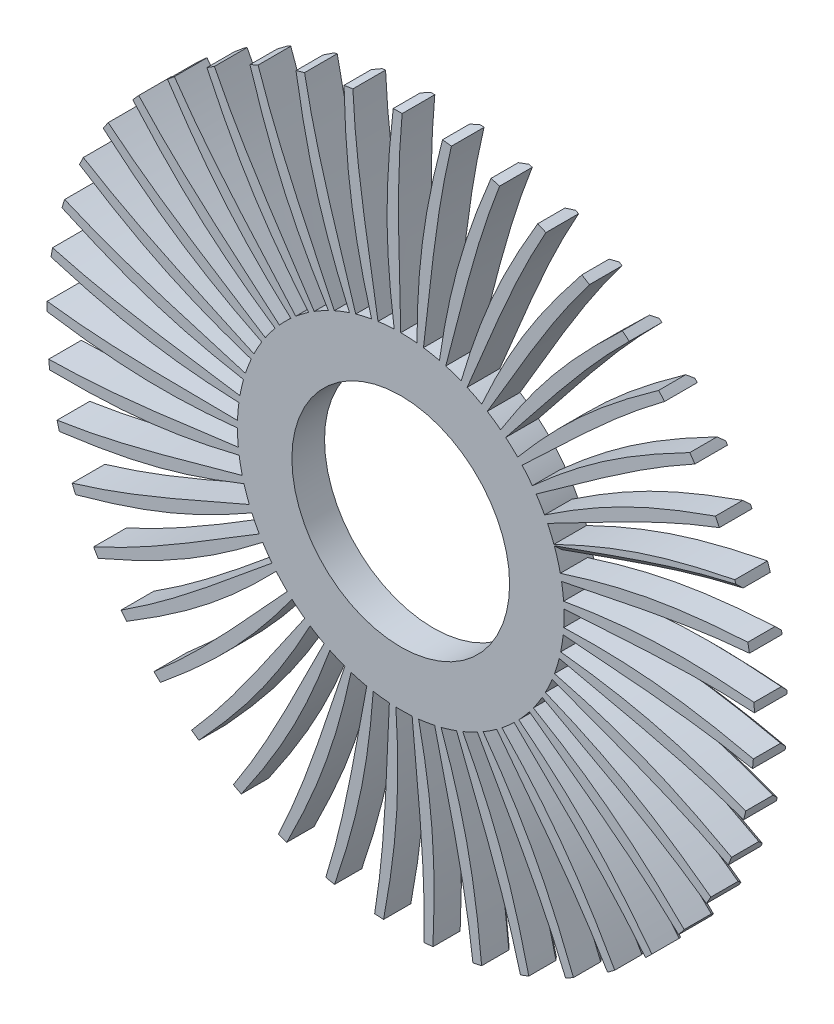
from build123d import *

# Parameters (mm, degrees)
BOSS_EXTRUDE1_DEPTH = 30
CHAMFER1_SIZE       = 5
SKETCH4_R           = 100
CUT_EXTRUDE4_DEPTH  = 30


with BuildPart() as part:
    # Sketch2 → Boss-Extrude1 (new body)
    with BuildSketch(Plane.XY):
        with BuildLine():
            ThreePointArc((255.305050597, -201.107760018), (257.825221713, -197.866508153), (260.304245812, -194.593678243))
            add(Edge.make_bspline(
                [(121.800982748, -87.547247825), (173.754400306, -117.703395416), (211.020458322, -147.138157234), (252.753415529, -187.143492092), (258.616357372, -192.917803148), (260.304245812, -194.593678243)],
                knots=[0, 0, 0, 0, 0.599000586, 0.668692091, 0.696915046, 0.696915046, 0.696915046, 0.696915046], degree=3))
            ThreePointArc((121.800982748, -87.547247825), (126.008666771, -81.37454085), (129.903810568, -75))
            add(Edge.make_bspline(
                [(129.903810568, -75), (182.276784142, -103.810645255), (231.484860292, -128.523589977), (280.809229984, -163.61899754)],
                knots=[0, 0, 0, 0, 0.716119663, 0.716119663, 0.716119663, 0.716119663], degree=3))
            ThreePointArc((280.809229984, -163.61899754), (282.853779894, -160.058549286), (284.853188414, -156.472556861))
            add(Edge.make_bspline(
                [(132.799845917, -69.743823558), (188.44458096, -92.375975367), (229.444495339, -116.337847252), (276.338976783, -150.145747874), (282.948489654, -155.047899935), (284.853188414, -156.472556861)],
                knots=[0, 0, 0, 0, 0.599000586, 0.668692091, 0.696915046, 0.696915046, 0.696915046, 0.696915046], degree=3))
            ThreePointArc((132.799845917, -69.743823558), (136.107506278, -63.04559251), (139.077578185, -56.190989012))
            add(Edge.make_bspline(
                [(139.077578185, -56.190989012), (194.950528422, -77.43234191), (247.119092108, -95.056341403), (300.847777124, -122.945577388)],
                knots=[0, 0, 0, 0, 0.716119663, 0.716119663, 0.716119663, 0.716119663], degree=3))
            ThreePointArc((300.847777124, -122.945577388), (302.376910991, -119.135232821), (303.857787719, -115.305875144))
            add(Edge.make_bspline(
                [(141.213911143, -50.582915098), (199.466902198, -65.250562033), (243.402656244, -83.273153405), (294.545914185, -110.225587462), (301.773351434, -114.160165714), (303.857787719, -115.305875144)],
                knots=[0, 0, 0, 0, 0.599000586, 0.668692091, 0.696915046, 0.696915046, 0.696915046, 0.696915046], degree=3))
            ThreePointArc((141.213911143, -50.582915098), (143.557167994, -43.489533425), (145.544358941, -36.28828434))
            add(Edge.make_bspline(
                [(145.544358941, -36.28828434), (203.829782419, -49.546906107), (257.94343189, -59.738929267), (315.030664493, -79.879161421)],
                knots=[0, 0, 0, 0, 0.716119663, 0.716119663, 0.716119663, 0.716119663], degree=3))
            ThreePointArc((315.030664493, -79.879161421), (316.014619465, -75.893084563), (316.948140819, -71.894895725))
            add(Edge.make_bspline(
                [(146.879408216, -30.437467733), (206.606827075, -36.855120731), (252.623261311, -48.587642349), (307.019850407, -68.16001137), (314.724538191, -71.050433722), (316.948140819, -71.894895725)],
                knots=[0, 0, 0, 0, 0.599000586, 0.668692091, 0.696915046, 0.696915046, 0.696915046, 0.696915046], degree=3))
            ThreePointArc((146.879408216, -30.437467733), (148.21265273, -23.08700004), (149.178284305, -15.67926949))
            add(Edge.make_bspline(
                [(149.178284305, -15.67926949), (208.741721554, -20.697096135), (263.747196176, -23.258766826), (323.081838319, -35.257988438)],
                knots=[0, 0, 0, 0, 0.716119663, 0.716119663, 0.716119663, 0.716119663], degree=3))
            ThreePointArc((323.081838319, -35.257988438), (323.501462832, -31.173763742), (323.869458881, -27.084563941))
            add(Edge.make_bspline(
                [(149.686064682, -9.699589681), (209.725385075, -7.742336426), (256.926841952, -12.956428102), (313.517994472, -24.767778187), (321.549969806, -26.557785857), (323.869458881, -27.084563941)],
                knots=[0, 0, 0, 0, 0.599000586, 0.668692091, 0.696915046, 0.696915046, 0.696915046, 0.696915046], degree=3))
            ThreePointArc((149.686064682, -9.699589681), (149.983346769, -2.235104461), (149.908624053, 5.234924505))
            add(Edge.make_bspline(
                [(149.908624053, 5.234924505), (209.590740519, 8.55555927), (264.417421297, 13.674101055), (324.844591662, 10.049441184)],
                knots=[0, 0, 0, 0, 0.716119663, 0.716119663, 0.716119663, 0.716119663], degree=3))
            ThreePointArc((324.844591662, 10.049441184), (324.691718202, 14.152318931), (324.487026323, 18.252938072))
            add(Edge.make_bspline(
                [(149.579252164, 11.227079851), (208.761877013, 21.521143651), (256.229633864, 22.92696828), (313.913867396, 19.106531625), (322.116797016, 18.4517791), (324.487026323, 18.252938072)],
                knots=[0, 0, 0, 0, 0.599000586, 0.668692091, 0.696915046, 0.696915046, 0.696915046, 0.696915046], degree=3))
            ThreePointArc((149.579252164, 11.227079851), (148.834785567, 18.660294884), (147.721162952, 26.04722665))
            add(Edge.make_bspline(
                [(147.721162952, 26.04722665), (206.360314125, 37.641690446), (259.941062083, 50.340818114), (320.284614534, 55.161269865)],
                knots=[0, 0, 0, 0, 0.716119663, 0.716119663, 0.716119663, 0.716119663], degree=3))
            ThreePointArc((320.284614534, 55.161269865), (319.562218609, 59.202942815), (318.788822895, 63.235167408))
            add(Edge.make_bspline(
                [(146.561049647, 31.935227045), (203.735056479, 50.365739146), (250.54520741, 58.364117303), (308.199763963, 62.608954532), (316.413987174, 63.102201167), (318.788822895, 63.235167408)],
                knots=[0, 0, 0, 0, 0.599000586, 0.668692091, 0.696915046, 0.696915046, 0.696915046, 0.696915046], degree=3))
            ThreePointArc((146.561049647, 31.935227045), (144.789324561, 39.192492815), (142.658477444, 46.352549156))
            add(Edge.make_bspline(
                [(142.658477444, 46.352549156), (199.113318949, 65.995168934), (250.405245773, 86.027708409), (309.490661702, 99.199447173)],
                knots=[0, 0, 0, 0, 0.716119663, 0.716119663, 0.716119663, 0.716119663], degree=3))
            ThreePointArc((309.490661702, 99.199447173), (308.212803927, 103.101248758), (306.885757647, 106.98659614))
            add(Edge.make_bspline(
                [(140.690203009, 52.02179137), (194.742764815, 78.230022819), (239.984203484, 92.665275172), (296.486902696, 104.892765357), (304.552538988, 106.524410665), (306.885757647, 106.98659614)],
                knots=[0, 0, 0, 0, 0.599000586, 0.668692091, 0.696915046, 0.696915046, 0.696915046, 0.696915046], degree=3))
            ThreePointArc((140.690203009, 52.02179137), (137.925704048, 58.961853455), (134.819106945, 65.755672018))
            add(Edge.make_bspline(
                [(134.819106945, 65.755672018), (187.990809508, 93.064126527), (235.995576187, 120.040167216), (292.67282518, 141.306820079)],
                knots=[0, 0, 0, 0, 0.716119663, 0.716119663, 0.716119663, 0.716119663], degree=3))
            ThreePointArc((292.67282518, 141.306820079), (290.864377604, 144.992806171), (289.009510203, 148.655652473))
            add(Edge.make_bspline(
                [(132.080981602, 71.0958107), (181.960026751, 104.571648084), (224.752180016, 125.162808864), (279.003261117, 145.134957817), (286.763322054, 147.873243679), (289.009510203, 148.655652473)],
                knots=[0, 0, 0, 0, 0.599000586, 0.668692091, 0.696915046, 0.696915046, 0.696915046, 0.696915046], degree=3))
            ThreePointArc((132.080981602, 71.0958107), (128.377516594, 77.583588684), (124.355635883, 83.878935521))
            add(Edge.make_bspline(
                [(124.355635883, 83.878935521), (173.209272795, 118.321696756), (216.992521151, 151.716180711), (270.158445027, 180.663816467)],
                knots=[0, 0, 0, 0, 0.716119663, 0.716119663, 0.716119663, 0.716119663], degree=3))
            ThreePointArc((270.158445027, 180.663816467), (267.854607024, 184.062243538), (265.508021387, 187.431295623))
            add(Edge.make_bspline(
                [(120.900954128, 88.786030945), (165.635643742, 128.877905167), (205.145611015, 155.224190852), (256.089138422, 182.552263412), (263.392583244, 186.343892208), (265.508021387, 187.431295623)],
                knots=[0, 0, 0, 0, 0.599000586, 0.668692091, 0.696915046, 0.696915046, 0.696915046, 0.696915046], degree=3))
            ThreePointArc((120.900954128, 88.786030945), (116.330606807, 94.69524761), (111.471723822, 100.369590954))
            add(Edge.make_bspline(
                [(111.471723822, 100.369590954), (155.056414611, 141.276269747), (193.765953516, 180.439211323), (242.385738042, 216.504397169)],
                knots=[0, 0, 0, 0, 0.716119663, 0.716119663, 0.716119663, 0.716119663], degree=3))
            ThreePointArc((242.385738042, 216.504397169), (239.631351198, 219.549118703), (236.838720946, 222.558801805))
            add(Edge.make_bspline(
                [(107.367727105, 104.74813209), (146.087351336, 150.675700422), (181.546116046, 182.264310531), (228.190531944, 216.416396849), (234.895207407, 221.187568839), (236.838720946, 222.558801805)],
                knots=[0, 0, 0, 0, 0.599000586, 0.668692091, 0.696915046, 0.696915046, 0.696915046, 0.696915046], degree=3))
            ThreePointArc((107.367727105, 104.74813209), (102.019454082, 109.963771256), (96.418141453, 114.906666468))
            add(Edge.make_bspline(
                [(96.418141453, 114.906666468), (133.88555969, 161.481060847), (166.767952002, 205.650197933), (209.895268376, 248.130966051)],
                knots=[0, 0, 0, 0, 0.716119663, 0.716119663, 0.716119663, 0.716119663], degree=3))
            ThreePointArc((209.895268376, 248.130966051), (206.743943698, 250.762720005), (203.559624201, 253.354454066))
            add(Edge.make_bspline(
                [(91.744709403, 118.671429993), (123.695634808, 169.54076456), (154.413032434, 205.756862727), (195.850456325, 246.068231292), (201.825863546, 251.726081039), (203.559624201, 253.354454066)],
                knots=[0, 0, 0, 0, 0.599000586, 0.668692091, 0.696915046, 0.696915046, 0.696915046, 0.696915046], degree=3))
            ThreePointArc((91.744709403, 118.671429993), (85.722608729, 123.091975176), (79.487889635, 127.207214423))
            add(Edge.make_bspline(
                [(79.487889635, 127.207214423), (110.108774642, 178.542806779), (136.524001997, 226.858437365), (173.319426063, 274.927947923)],
                knots=[0, 0, 0, 0, 0.716119663, 0.716119663, 0.716119663, 0.716119663], degree=3))
            ThreePointArc((173.319426063, 274.927947923), (169.832500501, 277.095510201), (166.318470917, 279.218850066))
            add(Edge.make_bspline(
                [(74.33598529, 130.284923498), (98.89632345, 185.105910565), (124.274474787, 225.244591636), (159.698374351, 270.930627512), (164.828208825, 277.365031406), (166.318470917, 279.218850066)],
                knots=[0, 0, 0, 0, 0.599000586, 0.668692091, 0.696915046, 0.696915046, 0.696915046, 0.696915046], degree=3))
            ThreePointArc((74.33598529, 130.284923498), (67.757270305, 133.824333814), (61.010496461, 137.031818646))
            add(Edge.make_bspline(
                [(61.010496461, 137.031818646), (84.188847543, 192.129420066), (103.622767587, 243.651135361), (133.37011827, 296.373770015)],
                knots=[0, 0, 0, 0, 0.716119663, 0.716119663, 0.716119663, 0.716119663], degree=3))
            ThreePointArc((133.37011827, 296.373770015), (129.615460864, 298.034951482), (125.840117781, 299.648568755))
            add(Edge.make_bspline(
                [(55.480395779, 139.362569165), (72.172107649, 197.068180576), (91.717055849, 240.34819078), (120.437945174, 290.519667246), (124.622360509, 297.605386935), (125.840117781, 299.648568755)],
                knots=[0, 0, 0, 0, 0.599000586, 0.668692091, 0.696915046, 0.696915046, 0.696915046, 0.696915046], degree=3))
            ThreePointArc((55.480395779, 139.362569165), (48.473113687, 141.951954018), (41.345603373, 144.189254391))
            add(Edge.make_bspline(
                [(41.345603373, 144.189254391), (56.630280289, 201.976452736), (68.704633876, 255.701441155), (90.82491283, 312.051013793)],
                knots=[0, 0, 0, 0, 0.716119663, 0.716119663, 0.716119663, 0.716119663], degree=3))
            ThreePointArc((90.82491283, 312.051013793), (86.875603717, 313.173481443), (82.912429893, 314.245968899))
            add(Edge.make_bspline(
                [(35.544943473, 145.727680945), (44.043143868, 205.194742614), (57.374468745, 250.773685782), (78.83332839, 304.454072118), (81.990879701, 312.053192128), (82.912429893, 314.245968899)],
                knots=[0, 0, 0, 0, 0.599000586, 0.668692091, 0.696915046, 0.696915046, 0.696915046, 0.696915046], degree=3))
            ThreePointArc((35.544943473, 145.727680945), (28.245483049, 147.316640904), (20.875965144, 148.540210311))
            add(Edge.make_bspline(
                [(20.875965144, 148.540210311), (27.969469046, 207.892243498), (32.449242616, 262.774809254), (46.511903775, 321.654539541)],
                knots=[0, 0, 0, 0, 0.716119663, 0.716119663, 0.716119663, 0.716119663], degree=3))
            ThreePointArc((46.511903775, 321.654539541), (42.444811762, 322.216445816), (38.370945869, 322.726928708))
            add(Edge.make_bspline(
                [(14.917649274, 149.256369178), (15.056930389, 209.327422392), (21.91515287, 256.318156242), (35.69431054, 312.462624788), (37.763539683, 320.427236892), (38.370945869, 322.726928708)],
                knots=[0, 0, 0, 0, 0.599000586, 0.668692091, 0.696915046, 0.696915046, 0.696915046, 0.696915046], degree=3))
            ThreePointArc((14.917649274, 149.256369178), (7.468086212, 149.813976946), (0, 150))
            add(Edge.make_bspline(
                [(0, 150), (-1.235736097, 209.761648215), (-4.43773624, 264.733564593), (1.293593419, 324.997425553)],
                knots=[0, 0, 0, 0, 0.716119663, 0.716119663, 0.716119663, 0.716119663], degree=3))
            ThreePointArc((1.293593419, 324.997425553), (-2.812120173, 324.987833588), (-6.91738497, 324.926375946))
            add(Edge.make_bspline(
                [(-6, 149.879951962), (-14.222349113, 209.385782), (-13.970716528, 256.873685348), (-8.139456462, 314.389447887), (-7.19882468, 322.56452997), (-6.91738497, 324.926375946)],
                knots=[0, 0, 0, 0, 0.599000586, 0.668692091, 0.696915046, 0.696915046, 0.696915046, 0.696915046], degree=3))
            ThreePointArc((-6, 149.879951962), (-13.454668429, 149.395354337), (-20.875965144, 148.540210311))
            add(Edge.make_bspline(
                [(-20.875965144, 148.540210311), (-30.416889043, 207.548281049), (-41.238339609, 261.539582227), (-43.949895261, 322.014606356)],
                knots=[0, 0, 0, 0, 0.716119663, 0.716119663, 0.716119663, 0.716119663], degree=3))
            ThreePointArc((-43.949895261, 322.014606356), (-48.014317387, 321.433702847), (-52.071076779, 320.801500874))
            add(Edge.make_bspline(
                [(-26.800866099, 147.586291966), (-43.224806767, 205.368685534), (-49.58466182, 252.429460358), (-51.814798203, 310.197037996), (-52.021072109, 318.423471384), (-52.071076779, 320.801500874)],
                knots=[0, 0, 0, 0, 0.599000586, 0.668692091, 0.696915046, 0.696915046, 0.696915046, 0.696915046], degree=3))
            ThreePointArc((-26.800866099, 147.586291966), (-34.115543253, 146.068921091), (-41.345603373, 144.189254391))
            add(Edge.make_bspline(
                [(-41.345603373, 144.189254391), (-59.006011842, 201.295222676), (-77.236285605, 253.255029389), (-88.337949224, 312.764139132)],
                knots=[0, 0, 0, 0, 0.716119663, 0.716119663, 0.716119663, 0.716119663], degree=3))
            ThreePointArc((-88.337949224, 312.764139132), (-92.281970529, 311.623230705), (-96.211264309, 310.432589494))
            add(Edge.make_bspline(
                [(-47.080083824, 142.420032675), (-71.385942725, 197.354321208), (-84.233498072, 243.071983057), (-94.481623835, 299.966995604), (-95.830788542, 308.084662129), (-96.211264309, 310.432589494)],
                knots=[0, 0, 0, 0, 0.599000586, 0.668692091, 0.696915046, 0.696915046, 0.696915046, 0.696915046], degree=3))
            ThreePointArc((-47.080083824, 142.420032675), (-54.112397833, 139.899422446), (-61.010496461, 137.031818646))
            add(Edge.make_bspline(
                [(-61.010496461, 137.031818646), (-86.446649739, 191.124181763), (-111.730915157, 240.041155478), (-131.006605486, 297.426073704)],
                knots=[0, 0, 0, 0, 0.716119663, 0.716119663, 0.716119663, 0.716119663], degree=3))
            ThreePointArc((-131.006605486, 297.426073704), (-134.753460084, 295.747366844), (-138.478809017, 294.021460872))
            add(Edge.make_bspline(
                [(-66.442941271, 134.481729448), (-98.157632508, 185.498679506), (-117.242825097, 228.983386096), (-135.309472131, 283.89843685), (-137.775267682, 291.749335366), (-138.478809017, 294.021460872)],
                knots=[0, 0, 0, 0, 0.599000586, 0.668692091, 0.696915046, 0.696915046, 0.696915046, 0.696915046], degree=3))
            ThreePointArc((-66.442941271, 134.481729448), (-73.056016141, 131.006940677), (-79.487889635, 127.207214423))
            add(Edge.make_bspline(
                [(-79.487889635, 127.207214423), (-112.204701931, 177.233126052), (-144.050829537, 222.155153518), (-171.125367191, 276.298948068)],
                knots=[0, 0, 0, 0, 0.716119663, 0.716119663, 0.716119663, 0.716119663], degree=3))
            ThreePointArc((-171.125367191, 276.298948068), (-174.602126818, 274.115116895), (-178.051021226, 271.887538958))
            add(Edge.make_bspline(
                [(-84.512562444, 123.925892328), (-123.018795627, 170.03251701), (-147.970153894, 210.437887989), (-173.503675463, 262.304117953), (-177.038107954, 269.735439651), (-178.051021226, 271.887538958)],
                knots=[0, 0, 0, 0, 0.599000586, 0.668692091, 0.696915046, 0.696915046, 0.696915046, 0.696915046], degree=3))
            ThreePointArc((-84.512562444, 123.925892328), (-90.577682196, 119.564557826), (-96.418141453, 114.906666468))
            add(Edge.make_bspline(
                [(-96.418141453, 114.906666468), (-135.77881723, 159.892429143), (-173.566958376, 199.945154193), (-207.913368276, 249.793977694)],
                knots=[0, 0, 0, 0, 0.716119663, 0.716119663, 0.716119663, 0.716119663], degree=3))
            ThreePointArc((-207.913368276, 249.793977694), (-211.052361761, 247.147527997), (-214.157672836, 244.461635366))
            add(Edge.make_bspline(
                [(-100.93724272, 110.957978677), (-145.48553782, 151.256864979), (-175.817411959, 187.796455762), (-208.320827111, 235.604347766), (-212.855102832, 242.471450422), (-214.157672836, 244.461635366)],
                knots=[0, 0, 0, 0, 0.599000586, 0.668692091, 0.696915046, 0.696915046, 0.696915046, 0.696915046], degree=3))
            ThreePointArc((-100.93724272, 110.957978677), (-106.336356696, 105.794986859), (-111.471723822, 100.369590954))
            add(Edge.make_bspline(
                [(-111.471723822, 100.369590954), (-156.710152298, 139.439607975), (-199.704803799, 173.843449876), (-240.654572145, 218.427051681)],
                knots=[0, 0, 0, 0, 0.716119663, 0.716119663, 0.716119663, 0.716119663], degree=3))
            ThreePointArc((-240.654572145, 218.427051681), (-243.39470255, 215.369493593), (-246.095988945, 212.277564112))
            add(Edge.make_bspline(
                [(-115.397294381, 95.830394184), (-165.120569508, 129.537170123), (-200.24258409, 161.499779139), (-239.08325082, 204.318806946), (-244.529115253, 210.488030218), (-246.095988945, 212.277564112)],
                knots=[0, 0, 0, 0, 0.599000586, 0.668692091, 0.696915046, 0.696915046, 0.696915046, 0.696915046], degree=3))
            ThreePointArc((-115.397294381, 95.830394184), (-120.02531497, 89.966236813), (-124.355635883, 83.878935521))
            add(Edge.make_bspline(
                [(-124.355635883, 83.878935521), (-174.591302507, 116.272753448), (-221.955622377, 144.35808055), (-268.711708508, 182.808691563)],
                knots=[0, 0, 0, 0, 0.716119663, 0.716119663, 0.716119663, 0.716119663], degree=3))
            ThreePointArc((-268.711708508, 182.808691563), (-270.999642312, 179.399536975), (-273.244326559, 175.961751535))
            add(Edge.make_bspline(
                [(-127.61126897, 78.837580074), (-181.541717132, 105.296181597), (-220.770262093, 132.059693018), (-265.192191005, 169.056432957), (-271.443646593, 174.407699933), (-273.244326559, 175.961751535)],
                knots=[0, 0, 0, 0, 0.599000586, 0.668692091, 0.696915046, 0.696915046, 0.696915046, 0.696915046], degree=3))
            ThreePointArc((-127.61126897, 78.837580074), (-131.378117014, 72.386396303), (-134.819106945, 65.755672018))
            add(Edge.make_bspline(
                [(-134.819106945, 65.755672018), (-189.074231607, 90.842782034), (-239.886327237, 112.062945392), (-291.538677119, 143.632168206)],
                knots=[0, 0, 0, 0, 0.716119663, 0.716119663, 0.716119663, 0.716119663], degree=3))
            ThreePointArc((-291.538677119, 143.632168206), (-293.329882293, 139.937772434), (-295.074274168, 136.221043618))
            add(Edge.make_bspline(
                [(-137.341435363, 60.310282144), (-194.429361732, 79.00572267), (-237.000898068, 100.049215188), (-286.139466844, 130.503567801), (-293.074836115, 134.932722154), (-295.074274168, 136.221043618)],
                knots=[0, 0, 0, 0, 0.599000586, 0.668692091, 0.696915046, 0.696915046, 0.696915046, 0.696915046], degree=3))
            ThreePointArc((-137.341435363, 60.310282144), (-140.173793452, 53.397636927), (-142.658477444, 46.352549156))
            add(Edge.make_bspline(
                [(-142.658477444, 46.352549156), (-199.877045858, 63.644659199), (-253.147917603, 77.586632472), (-308.691177001, 101.660008075)],
                knots=[0, 0, 0, 0, 0.716119663, 0.716119663, 0.716119663, 0.716119663], degree=3))
            ThreePointArc((-308.691177001, 101.660008075), (-309.950789774, 97.752278329), (-311.160936672, 93.828948036))
            add(Edge.make_bspline(
                [(-144.398406941, 40.609113174), (-203.532659967, 51.177507218), (-248.618581146, 66.091393189), (-301.517363439, 89.410599142), (-309.001657319, 92.831432422), (-311.160936672, 93.828948036)],
                knots=[0, 0, 0, 0, 0.599000586, 0.668692091, 0.696915046, 0.696915046, 0.696915046, 0.696915046], degree=3))
            ThreePointArc((-144.398406941, 40.609113174), (-146.241146445, 33.369553287), (-147.721162952, 26.04722665))
            add(Edge.make_bspline(
                [(-147.721162952, 26.04722665), (-206.789480768, 35.207765468), (-261.482271705, 41.600184004), (-319.835354254, 57.709151522)],
                knots=[0, 0, 0, 0, 0.716119663, 0.716119663, 0.716119663, 0.716119663], degree=3))
            ThreePointArc((-319.835354254, 57.709151522), (-320.538857695, 53.664147318), (-321.191205484, 49.61057871))
            add(Edge.make_bspline(
                [(-148.644827779, 20.117534009), (-208.67442649, 22.353179801), (-255.397186342, 30.847177399), (-311.026567526, 46.577354874), (-318.914112748, 48.923284452), (-321.191205484, 49.61057871)],
                knots=[0, 0, 0, 0, 0.599000586, 0.668692091, 0.696915046, 0.696915046, 0.696915046, 0.696915046], degree=3))
            ThreePointArc((-148.644827779, 20.117534009), (-149.462081869, 12.69196925), (-149.908624053, 5.234924505))
            add(Edge.make_bspline(
                [(-149.908624053, 5.234924505), (-209.676993654, 6.08559263), (-264.727170819, 4.804035273), (-324.754300143, 12.635051978)],
                knots=[0, 0, 0, 0, 0.716119663, 0.716119663, 0.716119663, 0.716119663], degree=3))
            ThreePointArc((-324.754300143, 12.635051978), (-324.888001359, 8.531504722), (-324.969852831, 4.4265959))
            add(Edge.make_bspline(
                [(-149.998046125, -0.765610073), (-209.754582665, -6.906226834), (-257.204775815, -4.99744361), (-314.481993264, 2.837535375), (-322.619267732, 4.0629004), (-324.969852831, 4.4265959)],
                knots=[0, 0, 0, 0, 0.599000586, 0.668692091, 0.696915046, 0.696915046, 0.696915046, 0.696915046], degree=3))
            ThreePointArc((-149.998046125, -0.765610073), (-149.77390788, -8.232649532), (-149.178284305, -15.67926949))
            add(Edge.make_bspline(
                [(-149.178284305, -15.67926949), (-208.483382363, -23.155029346), (-262.819456677, -32.085618539), (-323.352272983, -32.68497448)],
                knots=[0, 0, 0, 0, 0.716119663, 0.716119663, 0.716119663, 0.716119663], degree=3))
            ThreePointArc((-323.352272983, -32.68497448), (-322.913569631, -36.76719391), (-322.42333164, -40.843545564))
            add(Edge.make_bspline(
                [(-148.431723123, -21.633852425), (-206.752104481, -36.031211619), (-254.006166893, -40.744795065), (-311.816384721, -40.957513523), (-320.045005643, -40.876563387), (-322.42333164, -40.843545564)],
                knots=[0, 0, 0, 0, 0.599000586, 0.668692091, 0.696915046, 0.696915046, 0.696915046, 0.696915046], degree=3))
            ThreePointArc((-148.431723123, -21.633852425), (-147.17055514, -28.997029155), (-145.544358941, -36.28828434))
            add(Edge.make_bspline(
                [(-145.544358941, -36.28828434), (-203.231879181, -51.944965014), (-255.796260763, -68.350762283), (-315.656561637, -77.368825089)],
                knots=[0, 0, 0, 0, 0.716119663, 0.716119663, 0.716119663, 0.716119663], degree=3))
            ThreePointArc((-315.656561637, -77.368825089), (-314.653992579, -81.350260934), (-313.60120705, -85.318713873))
            add(Edge.make_bspline(
                [(-143.976345469, -42.081016449), (-199.72543176, -64.454889855), (-245.863616861, -75.699095429), (-303.081624935, -83.955371009), (-311.241431566, -85.020411365), (-313.60120705, -85.318713873)],
                knots=[0, 0, 0, 0, 0.599000586, 0.668692091, 0.696915046, 0.696915046, 0.696915046, 0.696915046], degree=3))
            ThreePointArc((-143.976345469, -42.081016449), (-141.702694948, -49.19701459), (-139.077578185, -56.190989012))
            add(Edge.make_bspline(
                [(-139.077578185, -56.190989012), (-194.024698643, -79.723851025), (-243.794281597, -103.285536188), (-301.816954373, -120.546779523)],
                knots=[0, 0, 0, 0, 0.716119663, 0.716119663, 0.716119663, 0.716119663], degree=3))
            ThreePointArc((-301.816954373, -120.546779523), (-300.270033475, -124.349937663), (-298.675191681, -128.133250464))
            add(Edge.make_bspline(
                [(-136.718632022, -61.709121353), (-188.811330695, -91.624026976), (-232.935611192, -109.179999008), (-288.44772607, -125.319132695), (-296.379897054, -127.509433744), (-298.675191681, -128.133250464)],
                knots=[0, 0, 0, 0, 0.599000586, 0.668692091, 0.696915046, 0.696915046, 0.696915046, 0.696915046], degree=3))
            ThreePointArc((-136.718632022, -61.709121353), (-133.476752983, -68.439436096), (-129.903810568, -75))
            add(Edge.make_bspline(
                [(-129.903810568, -75), (-181.041048045, -105.95100296), (-227.047124052, -136.209974616), (-282.102823403, -161.378428013)],
                knots=[0, 0, 0, 0, 0.716119663, 0.716119663, 0.716119663, 0.716119663], degree=3))
            ThreePointArc((-282.102823403, -161.378428013), (-280.041659722, -164.929284302), (-277.935803443, -168.453819085))
            add(Edge.make_bspline(
                [(-126.799845917, -80.136128403), (-174.222231847, -117.009806633), (-215.473778811, -140.535838097), (-268.199520321, -164.243700013), (-275.749664974, -167.516630035), (-277.935803443, -168.453819085)],
                knots=[0, 0, 0, 0, 0.599000586, 0.668692091, 0.696915046, 0.696915046, 0.696915046, 0.696915046], degree=3))
            ThreePointArc((-126.799845917, -80.136128403), (-122.652837849, -86.349761827), (-118.201613041, -92.349221299))
            add(Edge.make_bspline(
                [(-118.201613041, -92.349221299), (-164.533639379, -130.11593914), (-205.880752499, -166.483240824), (-256.897881863, -199.069028968)],
                knots=[0, 0, 0, 0, 0.716119663, 0.716119663, 0.716119663, 0.716119663], degree=3))
            ThreePointArc((-256.897881863, -199.069028968), (-254.362593604, -202.298470026), (-251.786710939, -205.49562573))
            add(Edge.make_bspline(
                [(-114.413045044, -97.003376868), (-156.242095431, -140.118123501), (-193.817994424, -169.156306954), (-242.731115982, -199.971450533), (-249.752279326, -204.26330567), (-251.786710939, -205.49562573)],
                knots=[0, 0, 0, 0, 0.599000586, 0.668692091, 0.696915046, 0.696915046, 0.696915046, 0.696915046], degree=3))
            ThreePointArc((-114.413045044, -97.003376868), (-109.441624742, -102.579387666), (-104.198755569, -107.900970051))
            add(Edge.make_bspline(
                [(-104.198755569, -107.900970051), (-144.823770577, -151.748316569), (-180.707146285, -193.516100122), (-226.69271527, -232.884977711)],
                knots=[0, 0, 0, 0, 0.716119663, 0.716119663, 0.716119663, 0.716119663], degree=3))
            ThreePointArc((-226.69271527, -232.884977711), (-223.732648936, -235.730146142), (-220.73687651, -238.537693769))
            add(Edge.make_bspline(
                [(-99.799324392, -111.982564942), (-135.22088435, -160.499200477), (-168.38976324, -194.484340708), (-212.538226573, -231.806984234), (-218.893749649, -237.034228406), (-220.73687651, -238.537693769)],
                knots=[0, 0, 0, 0, 0.599000586, 0.668692091, 0.696915046, 0.696915046, 0.696915046, 0.696915046], degree=3))
            ThreePointArc((-99.799324392, -111.982564942), (-94.100254897, -116.812422406), (-88.167787844, -121.352549156))
            add(Edge.make_bspline(
                [(-88.167787844, -121.352549156), (-122.295071814, -170.427085628), (-152.01628102, -216.782388653), (-192.075232833, -262.168085266)],
                knots=[0, 0, 0, 0, 0.716119663, 0.716119663, 0.716119663, 0.716119663], degree=3))
            ThreePointArc((-192.075232833, -262.168085266), (-188.748002748, -264.573603103), (-185.390649864, -266.936896931))
            add(Edge.make_bspline(
                [(-83.243123411, -124.782139767), (-111.567752567, -177.75634308), (-139.684016855, -216.026957994), (-178.208522342, -259.130658663), (-183.774702124, -265.191549509), (-185.390649864, -266.936896931)],
                knots=[0, 0, 0, 0, 0.599000586, 0.668692091, 0.696915046, 0.696915046, 0.696915046, 0.696915046], degree=3))
            ThreePointArc((-83.243123411, -124.782139767), (-76.927330628, -128.771836216), (-70.420734418, -132.442138929))
            add(Edge.make_bspline(
                [(-70.420734418, -132.442138929), (-97.386038588, -185.788685322), (-120.36659176, -235.829254574), (-153.719224471, -286.348389253)],
                knots=[0, 0, 0, 0, 0.716119663, 0.716119663, 0.716119663, 0.716119663], degree=3))
            ThreePointArc((-153.719224471, -286.348389253), (-150.089591384, -288.267435827), (-146.436005097, -290.14047703))
            add(Edge.make_bspline(
                [(-65.066689721, -135.152972179), (-85.743081387, -191.55366066), (-108.25947997, -233.364856269), (-140.410191933, -281.410649578), (-145.078689062, -288.187218751), (-146.436005097, -290.14047703)],
                knots=[0, 0, 0, 0, 0.599000586, 0.668692091, 0.696915046, 0.696915046, 0.696915046, 0.696915046], degree=3))
            ThreePointArc((-65.066689721, -135.152972179), (-58.257103372, -138.22485271), (-51.303021499, -140.953893118))
            add(Edge.make_bspline(
                [(-51.303021499, -140.953893118), (-70.581496895, -197.534119588), (-86.374103707, -250.285972307), (-112.371246258, -304.95524756)],
                knots=[0, 0, 0, 0, 0.716119663, 0.716119663, 0.716119663, 0.716119663], degree=3))
            ThreePointArc((-112.371246258, -304.95524756), (-108.509856848, -306.350470812), (-104.63115006, -307.696802774))
            add(Edge.make_bspline(
                [(-45.623806927, -142.893205722), (-58.249518658, -201.622604125), (-74.727795451, -246.160573065), (-99.878936852, -298.213302298), (-103.558884342, -305.573651589), (-104.63115006, -307.696802774)],
                knots=[0, 0, 0, 0, 0.599000586, 0.668692091, 0.696915046, 0.696915046, 0.696915046, 0.696915046], degree=3))
            ThreePointArc((-45.623806927, -142.893205722), (-38.452967865, -144.987479675), (-31.186753623, -146.72214011))
            add(Edge.make_bspline(
                [(-31.186753623, -146.72214011), (-42.403166651, -205.434776909), (-50.700441975, -259.871158285), (-68.836089558, -317.626498854)],
                knots=[0, 0, 0, 0, 0.716119663, 0.716119663, 0.716119663, 0.716119663], degree=3))
            ThreePointArc((-68.836089558, -317.626498854), (-64.818101377, -318.470742351), (-60.789768702, -319.264160252))
            add(Edge.make_bspline(
                [(-25.292908628, -147.852185554), (-29.622195307, -207.767192943), (-39.741619395, -254.16505431), (-57.403651876, -309.211572302), (-60.023423735, -317.012440883), (-60.789768702, -319.264160252)],
                knots=[0, 0, 0, 0, 0.599000586, 0.668692091, 0.696915046, 0.696915046, 0.696915046, 0.696915046], degree=3))
            ThreePointArc((-25.292908628, -147.852185554), (-17.900389078, -148.928090268), (-10.463471062, -149.634607539))
            add(Edge.make_bspline(
                [(-10.463471062, -149.634607539), (-13.399507, -209.336879975), (-14.03995381, -264.398247766), (-23.961116673, -324.115511643)],
                knots=[0, 0, 0, 0, 0.716119663, 0.716119663, 0.716119663, 0.716119663], degree=3))
            ThreePointArc((-23.961116673, -324.115511643), (-19.864735292, -324.392343146), (-15.765183644, -324.617404008))
            add(Edge.make_bspline(
                [(-4.469712632, -149.933390774), (-0.418309619, -209.867829681), (-3.981917923, -257.222501882), (-13.811070112, -314.191390774), (-15.319675461, -322.280943612), (-15.765183644, -324.617404008)],
                knots=[0, 0, 0, 0, 0.599000586, 0.668692091, 0.696915046, 0.696915046, 0.696915046, 0.696915046], degree=3))
            ThreePointArc((-4.469712632, -149.933390774), (3.00060042, -149.969984987), (10.463471062, -149.634607539))
            add(Edge.make_bspline(
                [(10.463471062, -149.634607539), (15.864958812, -209.16447879), (22.893806085, -263.779126103), (21.380232092, -324.295984674)],
                knots=[0, 0, 0, 0, 0.716119663, 0.716119663, 0.716119663, 0.716119663], degree=3))
            ThreePointArc((21.380232092, -324.295984674), (25.47527527, -324.000015972), (29.566252781, -323.652339242))
            add(Edge.make_bspline(
                [(16.440481235, -149.096313089), (28.79371799, -207.883627836), (31.855287052, -255.27340604), (30.050328422, -313.055831212), (29.68225287, -321.276614362), (29.566252781, -323.652339242)],
                knots=[0, 0, 0, 0, 0.599000586, 0.668692091, 0.696915046, 0.696915046, 0.696915046, 0.696915046], degree=3))
            ThreePointArc((16.440481235, -149.096313089), (23.843186645, -148.092884537), (31.186753623, -146.72214011))
            add(Edge.make_bspline(
                [(31.186753623, -146.72214011), (44.820631247, -204.920928946), (59.381964087, -258.025843795), (66.305438959, -318.164405244)],
                knots=[0, 0, 0, 0, 0.716119663, 0.716119663, 0.716119663, 0.716119663], degree=3))
            ThreePointArc((66.305438959, -318.164405244), (70.319438576, -317.301397032), (74.322215726, -316.387749841))
            add(Edge.make_bspline(
                [(37.030679836, -145.357245264), (57.445308631, -201.85320764), (67.0724651, -248.35570372), (73.326831495, -305.826995991), (74.106449913, -314.019001261), (74.322215726, -316.387749841)],
                knots=[0, 0, 0, 0, 0.599000586, 0.668692091, 0.696915046, 0.696915046, 0.696915046, 0.696915046], degree=3))
            ThreePointArc((37.030679836, -145.357245264), (44.221692363, -143.333324543), (51.303021499, -140.953893118))
            add(Edge.make_bspline(
                [(51.303021499, -140.953893118), (72.903921078, -196.688826314), (94.714319703, -247.250381937), (109.940085878, -305.840117573)],
                knots=[0, 0, 0, 0, 0.716119663, 0.716119663, 0.716119663, 0.716119663], degree=3))
            ThreePointArc((109.940085878, -305.840117573), (113.794913998, -304.426867323), (117.631581283, -302.965032776))
            add(Edge.make_bspline(
                [(56.900118376, -138.788964002), (84.978791682, -191.893944361), (100.984153908, -236.604040126), (115.176111201, -292.645586167), (117.088249202, -300.649365491), (117.631581283, -302.965032776)],
                knots=[0, 0, 0, 0, 0.599000586, 0.668692091, 0.696915046, 0.696915046, 0.696915046, 0.696915046], degree=3))
            ThreePointArc((56.900118376, -138.788964002), (63.73947314, -135.783944426), (70.420734418, -132.442138929))
            add(Edge.make_bspline(
                [(70.420734418, -132.442138929), (99.568219012, -184.628399409), (128.203168822, -231.662472638), (151.43487408, -287.562999902)],
                knots=[0, 0, 0, 0, 0.716119663, 0.716119663, 0.716119663, 0.716119663], degree=3))
            ThreePointArc((151.43487408, -287.562999902), (155.055500858, -285.627014923), (158.651381914, -283.645445965))
            add(Edge.make_bspline(
                [(75.662060835, -129.519313426), (110.858259215, -178.199683731), (132.930301028, -220.247148025), (154.783618913, -273.768162887), (157.791058907, -281.427931806), (158.651381914, -283.645445965)],
                knots=[0, 0, 0, 0, 0.599000586, 0.668692091, 0.696915046, 0.696915046, 0.696915046, 0.696915046], degree=3))
            ThreePointArc((75.662060835, -129.519313426), (82.016637575, -125.591684282), (88.167787844, -121.352549156))
            add(Edge.make_bspline(
                [(88.167787844, -121.352549156), (124.29453482, -168.97439072), (159.196689089, -211.565516822), (189.982154713, -263.688795535)],
                knots=[0, 0, 0, 0, 0.716119663, 0.716119663, 0.716119663, 0.716119663], degree=3))
            ThreePointArc((189.982154713, -263.688795535), (193.298108767, -261.267757573), (196.583213859, -258.805023191))
            add(Edge.make_bspline(
                [(92.951327344, -117.728716739), (134.579996832, -161.036968957), (162.289111045, -199.603395715), (191.378439547, -249.562153723), (195.422645135, -256.728823548), (196.583213859, -258.805023191)],
                knots=[0, 0, 0, 0, 0.599000586, 0.668692091, 0.696915046, 0.696915046, 0.696915046, 0.696915046], degree=3))
            ThreePointArc((92.951327344, -117.728716739), (98.697441453, -112.954924862), (104.198755569, -107.900970051))
            add(Edge.make_bspline(
                [(104.198755569, -107.900970051), (146.601598891, -150.031487722), (187.091626887, -187.350678872), (224.831648806, -234.682188705)],
                knots=[0, 0, 0, 0, 0.716119663, 0.716119663, 0.716119663, 0.716119663], degree=3))
            ThreePointArc((224.831648806, -234.682188705), (227.778388862, -231.823220509), (230.688777157, -228.927255026))
            add(Edge.make_bspline(
                [(108.431401996, -103.646664496), (155.682287893, -140.739852759), (188.489148116, -175.074590353), (224.248296545, -220.498701109), (229.250551865, -227.032780764), (230.688777157, -228.927255026)],
                knots=[0, 0, 0, 0, 0.599000586, 0.668692091, 0.696915046, 0.696915046, 0.696915046, 0.696915046], degree=3))
            ThreePointArc((108.431401996, -103.646664496), (113.457211899, -98.119626314), (118.201613041, -92.349221299))
            add(Edge.make_bspline(
                [(118.201613041, -92.349221299), (166.055229596, -128.168392474), (211.34503898, -159.489273067), (255.305050597, -201.107760018)],
                knots=[0, 0, 0, 0, 0.716119663, 0.716119663, 0.716119663, 0.716119663], degree=3))
        make_face()
    extrude(amount=BOSS_EXTRUDE1_DEPTH)

    # Chamfer1
    chamfer1_edges = [part.edges().sort_by_distance(p)[0] for p in [
        (149.708503976, -184.62758704, 0),
        (173.946744917, -161.995407317, 0),
        (194.799310331, -136.210171256, 0),
        (211.860328749, -107.773759149, 0),
        (224.797726857, -77.239653411, 0),
        (233.359692914, -45.202165679, 0),
        (237.379577992, -12.284869207, 0),
        (236.779139599, 20.871538269, 0),
        (231.570064586, 53.621704994, 0),
        (225.303418497, 75.274500059, 30),
        (207.819288034, 115.37385137, 0),
        (189.739868344, 143.173895735, 0),
        (167.967377942, 168.187223077, 0),
        (142.925593589, 189.926977432, 0),
        (115.101925132, 207.970019209, 0),
        (85.037928629, 221.965161126, 0),
        (53.318765574, 231.640003662, 0),
        (20.561813396, 236.806237014, 0),
        (-12.59535109, 237.363306326, 0),
        (-45.507361395, 233.300368876, 0),
        (-77.533622673, 224.696505122, 0),
        (-108.05078018, 211.719179484, 0),
        (-136.464852156, 194.620980845, 0),
        (-162.222791012, 173.734706191, 0),
        (-184.823247766, 149.466883101, 0),
        (-203.826330236, 122.289857149, 0),
        (-218.862165037, 92.732598229, 0),
        (-229.638096747, 61.370404766, 0),
        (-235.944384114, 28.813706183, 0),
        (-237.658282427, -4.303818416, 0),
        (-234.746432604, -37.337574085, 0),
        (-227.265510491, -69.644596346, 0),
        (-215.361123727, -100.596065758, 0),
        (-199.264977659, -129.589547176, 0),
        (-179.290365462, -156.060715465, 0),
        (-155.826070241, -179.494339444, 0),
        (-129.328797812, -199.434310277, 0),
        (-100.314287443, -215.492519113, 0),
        (-69.347273574, -227.356411185, 0),
        (-37.030493907, -234.795069326, 0),
        (-3.992957798, -237.663708519, 0),
        (29.122296693, -235.906493964, 0),
        (61.670718805, -229.557627843, 0),
        (93.018790525, -218.740683615, 0),
        (122.556357295, -203.666200793, 0),
    ]]
    chamfer(chamfer1_edges, length=CHAMFER1_SIZE)

    # Sketch4 → Cut-Extrude4 (cut)
    with BuildSketch(Plane.XY.offset(30)):
        Circle(SKETCH4_R)
    extrude(amount=-CUT_EXTRUDE4_DEPTH, mode=Mode.SUBTRACT)


solid = part.part
